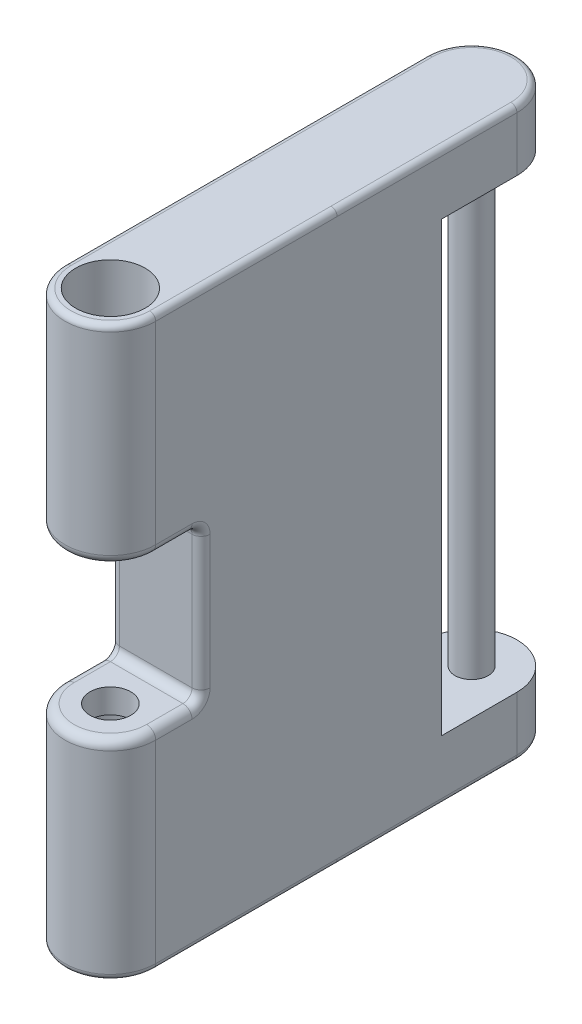
from build123d import *

# Parameters (mm, degrees)
SKETCH1_R               = 1.397
BOSS_EXTRUDE1_DEPTH     = 18.796
BOSS_EXTRUDE2_DEPTH     = 5.08
SKETCH3_W               = 7.62
SKETCH3_H               = 8.763
BOSS_EXTRUDE3_DEPTH     = 23.876
FILLET1_R               = 0.508
BOSS_EXTRUDE5_DEPTH     = 47.752
FILLET3_R               = 0.508
CUT_EXTRUDE2_DEPTH      = 43.370253148
CUT_EXTRUDE2_DEPTH_BACK = 43.370253148
SKETCH9_W               = 7.62
SKETCH9_H               = 12.7
FILLET4_R               = 0.762
CUT_EXTRUDE3_DEPTH      = 59.837744517
CUT_EXTRUDE3_DEPTH_BACK = 15.494
SKETCH10_R              = 2.921
CUT_EXTRUDE4_DEPTH      = 48.140271953
CUT_EXTRUDE4_DEPTH_BACK = 48.140271953
SKETCH11_R              = 1.7145
CUT_EXTRUDE5_DEPTH      = 59.837744517
CUT_EXTRUDE5_DEPTH_BACK = 15.494
SKETCH12_R              = 3.3655


with BuildPart() as part:
    # Sketch1 → Boss-Extrude1 (new body)
    with BuildSketch(Plane(origin=(0, 0, 0), x_dir=(1, 0, 0), z_dir=(0, 1, 0))):
        with Locations(Location((0, 0, 0), (0, 0, 270))):
            Circle(SKETCH1_R)
    extrude(amount=BOSS_EXTRUDE1_DEPTH)

    # Sketch2 → Boss-Extrude2 (add)
    with BuildSketch(Plane(origin=(0, 18.796, 0), x_dir=(1, 0, 0), z_dir=(0, 1, 0))):
        with BuildLine():
            Line((-3.81, -6.35), (3.81, -6.35))
            Line((3.81, -6.35), (3.81, 0))
            ThreePointArc((3.81, 0), (0, 3.81), (-3.81, 0))
            Line((-3.81, 0), (-3.81, -6.35))
        make_face()
    extrude(amount=BOSS_EXTRUDE2_DEPTH)

    # Sketch3 → Boss-Extrude3 (add)
    with BuildSketch(Plane(origin=(0, 23.876, 0), x_dir=(1, 0, 0), z_dir=(0, 1, 0))):
        with Locations((0, -10.7315)):
            Rectangle(SKETCH3_W, SKETCH3_H)
    extrude(amount=-BOSS_EXTRUDE3_DEPTH)

    # Mirror1: part across plane


with BuildPart() as part_1:
    add(part.part)
    add(part.part.mirror(Plane.ZX))

    # Fillet1
    fillet1_edges = [part_1.edges().sort_by_distance(p)[0] for p in [
        (-3.81, -23.876, 7.5565),
        (3.81, -23.876, 7.5565),
        (0, -23.876, -3.81),
        (-3.81, 23.876, 7.5565),
        (3.81, 23.876, 7.5565),
        (0, 23.876, -3.81),
    ]]
    fillet(fillet1_edges, radius=FILLET1_R)

    # Sketch8 → Boss-Extrude5 (add)
    with BuildSketch(Plane(origin=(0, 23.876, 0), x_dir=(1, 0, 0), z_dir=(0, 1, 0))):
        with BuildLine():
            Line((-3.81, -15.113), (3.81, -15.113))
            Line((3.81, -15.113), (3.81, -30.353))
            ThreePointArc((3.81, -30.353), (0, -34.163), (-3.81, -30.353))
            Line((-3.81, -30.353), (-3.81, -15.113))
        make_face()
    extrude(amount=-BOSS_EXTRUDE5_DEPTH)

    # Fillet3
    fillet3_edges = [part_1.edges().sort_by_distance(p)[0] for p in [
        (-3.81, 23.876, 22.733),
        (0, 23.876, 34.163),
        (3.81, 23.876, 22.733),
        (0, -23.876, 34.163),
        (3.81, -23.876, 22.733),
        (-3.81, -23.876, 22.733),
    ]]
    fillet(fillet3_edges, radius=FILLET3_R)

    # Sketch9 → Cut-Extrude2 (cut, two sides: drawn at the far end of the back side and taken through both)
    with BuildSketch(Plane.ZY.offset(3.81).offset(-CUT_EXTRUDE2_DEPTH_BACK)):
        with Locations((30.353, 0)):
            Rectangle(SKETCH9_W, SKETCH9_H)
    extrude(amount=CUT_EXTRUDE2_DEPTH + CUT_EXTRUDE2_DEPTH_BACK, mode=Mode.SUBTRACT)

    # Fillet4
    fillet4_edges = [part_1.edges().sort_by_distance(p)[0] for p in [
        (0, 6.35, 34.163),
        (0, -6.35, 34.163),
        (0, -6.35, 26.543),
        (-3.81, 0, 26.543),
        (3.81, 0, 26.543),
        (-3.81, -6.35, 28.448),
        (3.81, -6.35, 28.448),
        (0, 6.35, 26.543),
        (-3.81, 6.35, 28.448),
        (3.81, 6.35, 28.448),
    ]]
    fillet(fillet4_edges, radius=FILLET4_R)

    # Sketch10 → Cut-Extrude3 (cut, two sides: drawn at the far end of the back side and taken through both)
    with BuildSketch(Plane(origin=(0, 23.876, 0), x_dir=(1, 0, 0), z_dir=(0, 1, 0)).offset(-CUT_EXTRUDE3_DEPTH_BACK)):
        with Locations(Location((0, -30.353, 0), (0, 0, 90))):
            Circle(SKETCH10_R)
    extrude(amount=CUT_EXTRUDE3_DEPTH + CUT_EXTRUDE3_DEPTH_BACK, mode=Mode.SUBTRACT)

    # Sketch11 → Cut-Extrude4 (cut, two sides: drawn at the far end of the back side and taken through both)
    with BuildSketch(Plane(origin=(0, 8.382, 0), x_dir=(1, 0, 0), z_dir=(0, 1, 0)).offset(-CUT_EXTRUDE4_DEPTH_BACK)):
        with Locations(Location((0, -30.353, 0), (0, 0, 270))):
            Circle(SKETCH11_R)
    extrude(amount=CUT_EXTRUDE4_DEPTH + CUT_EXTRUDE4_DEPTH_BACK, mode=Mode.SUBTRACT)

    # Sketch12 → Cut-Extrude5 (cut, two sides: drawn at the far end of the back side and taken through both)
    with BuildSketch(Plane.XZ.offset(23.876).offset(-CUT_EXTRUDE5_DEPTH_BACK)):
        with Locations(Location((0, 30.353, 0), (0, 0, 180))):
            Circle(SKETCH12_R)
    extrude(amount=CUT_EXTRUDE5_DEPTH + CUT_EXTRUDE5_DEPTH_BACK, mode=Mode.SUBTRACT)


solid = part_1.part
